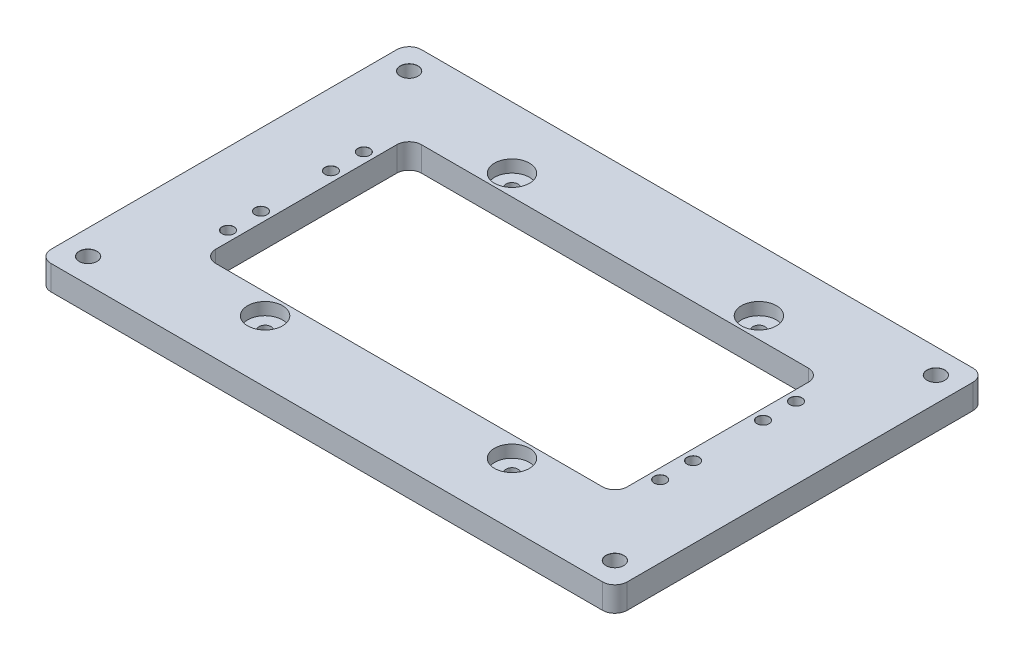
from build123d import *

# Parameters (mm, degrees)
SKETCH1_W                            = 140
SKETCH1_H                            = 90
BOSS_EXTRUDE1_DEPTH                  = 6
FILLET1_R                            = 3
SKETCH2_W                            = 100
SKETCH2_H                            = 50
CUT_EXTRUDE1_DEPTH                   = 10
FILLET2_R                            = 3
F_2_9_2_9_DIAMETER_HOLE1_D           = 2.9
F_2_9_2_9_DIAMETER_HOLE1_DEPTH       = 15
F_2_9_2_9_DIAMETER_HOLE1_CSINK_D     = 2.95
F_2_9_2_9_DIAMETER_HOLE1_CSINK_ANGLE = 90
F_2_9_2_9_DIAMETER_HOLE1_TIP         = 0.871247898
F_2_9_2_9_DIAMETER_HOLE2_D           = 2.9
F_2_9_2_9_DIAMETER_HOLE2_DEPTH       = 15
F_2_9_2_9_DIAMETER_HOLE2_CSINK_D     = 2.95
F_2_9_2_9_DIAMETER_HOLE2_CSINK_ANGLE = 90
F_2_9_2_9_DIAMETER_HOLE2_TIP         = 0.871247898
SKETCH7_R                            = 4.25
CUT_EXTRUDE2_DEPTH                   = 3
F_4_3_4_3_DIAMETER_HOLE1_D           = 4.3
F_4_3_4_3_DIAMETER_HOLE1_DEPTH       = 15
F_4_3_4_3_DIAMETER_HOLE1_CSINK_D     = 4.35
F_4_3_4_3_DIAMETER_HOLE1_CSINK_ANGLE = 90
F_4_3_4_3_DIAMETER_HOLE1_TIP         = 1.291850331


with BuildPart() as part:
    # Sketch1 → Boss-Extrude1 (new body)
    with BuildSketch(Plane(origin=(0, 0, 0), x_dir=(1, 0, 0), z_dir=(0, 1, 0))):
        Rectangle(SKETCH1_W, SKETCH1_H)
    extrude(amount=BOSS_EXTRUDE1_DEPTH)

    # Fillet1
    fillet1_edges = [part.edges().sort_by_distance(p)[0] for p in [
        (70, 3, 45),
        (-70, 3, 45),
        (-70, 3, -45),
        (70, 3, -45),
    ]]
    fillet(fillet1_edges, radius=FILLET1_R)

    # Sketch2 → Cut-Extrude1 (cut)
    with BuildSketch(Plane(origin=(0, 6, 0), x_dir=(1, 0, 0), z_dir=(0, 1, 0))):
        Rectangle(SKETCH2_W, SKETCH2_H)
    extrude(amount=-CUT_EXTRUDE1_DEPTH, mode=Mode.SUBTRACT)

    # Fillet2
    fillet2_edges = [part.edges().sort_by_distance(p)[0] for p in [
        (50, 3, -25),
        (50, 3, 25),
        (-50, 3, 25),
        (-50, 3, -25),
    ]]
    fillet(fillet2_edges, radius=FILLET2_R)

    # Ø2.9 (2.9) Diameter Hole1
    with Locations(Plane(origin=(0, 6, 0), x_dir=(1, 0, 0), z_dir=(0, 1, 0))):
        with Locations((0, 0), (-52.5, 16.5), (-52.5, 8.5), (-52.5, -8.5), (-52.5, -16.5), (52.5, 16.5), (52.5, 8.5), (52.5, -8.5), (52.5, -16.5)):
            CounterSinkHole(F_2_9_2_9_DIAMETER_HOLE1_D / 2, F_2_9_2_9_DIAMETER_HOLE1_CSINK_D / 2, depth=F_2_9_2_9_DIAMETER_HOLE1_DEPTH, counter_sink_angle=F_2_9_2_9_DIAMETER_HOLE1_CSINK_ANGLE)
            with Locations((0, 0, -(F_2_9_2_9_DIAMETER_HOLE1_DEPTH + F_2_9_2_9_DIAMETER_HOLE1_TIP / 2))):  # 118° drill point
                Cone(0, F_2_9_2_9_DIAMETER_HOLE1_D / 2, F_2_9_2_9_DIAMETER_HOLE1_TIP, mode=Mode.SUBTRACT)

    # Ø2.9 (2.9) Diameter Hole2
    with Locations(Plane(origin=(0, 6, 0), x_dir=(1, 0, 0), z_dir=(0, 1, 0))):
        with Locations((0, 0), (30, -30), (-30, 30), (-30, -30), (30, 30)):
            CounterSinkHole(F_2_9_2_9_DIAMETER_HOLE2_D / 2, F_2_9_2_9_DIAMETER_HOLE2_CSINK_D / 2, depth=F_2_9_2_9_DIAMETER_HOLE2_DEPTH, counter_sink_angle=F_2_9_2_9_DIAMETER_HOLE2_CSINK_ANGLE)
            with Locations((0, 0, -(F_2_9_2_9_DIAMETER_HOLE2_DEPTH + F_2_9_2_9_DIAMETER_HOLE2_TIP / 2))):  # 118° drill point
                Cone(0, F_2_9_2_9_DIAMETER_HOLE2_D / 2, F_2_9_2_9_DIAMETER_HOLE2_TIP, mode=Mode.SUBTRACT)

    # Sketch7 → Cut-Extrude2 (cut)
    with BuildSketch(Plane(origin=(0, 6, 0), x_dir=(1, 0, 0), z_dir=(0, 1, 0))):
        with Locations(Location((-30, 30, 0), (0, 0, 270))):
            Circle(SKETCH7_R)
        with Locations(Location((30, 30, 0), (0, 0, 270))):
            Circle(SKETCH7_R)
        with Locations(Location((30, -30, 0), (0, 0, 270))):
            Circle(SKETCH7_R)
        with Locations(Location((-30, -30, 0), (0, 0, 270))):
            Circle(SKETCH7_R)
    extrude(amount=-CUT_EXTRUDE2_DEPTH, mode=Mode.SUBTRACT)

    # Ø4.3 (4.3) Diameter Hole1
    with Locations(Plane(origin=(0, 6, 0), x_dir=(1, 0, 0), z_dir=(0, 1, 0))):
        with Locations((0, 0), (64, -39), (-64, 39), (-64, -39), (64, 39)):
            CounterSinkHole(F_4_3_4_3_DIAMETER_HOLE1_D / 2, F_4_3_4_3_DIAMETER_HOLE1_CSINK_D / 2, depth=F_4_3_4_3_DIAMETER_HOLE1_DEPTH, counter_sink_angle=F_4_3_4_3_DIAMETER_HOLE1_CSINK_ANGLE)
            with Locations((0, 0, -(F_4_3_4_3_DIAMETER_HOLE1_DEPTH + F_4_3_4_3_DIAMETER_HOLE1_TIP / 2))):  # 118° drill point
                Cone(0, F_4_3_4_3_DIAMETER_HOLE1_D / 2, F_4_3_4_3_DIAMETER_HOLE1_TIP, mode=Mode.SUBTRACT)


solid = part.part
